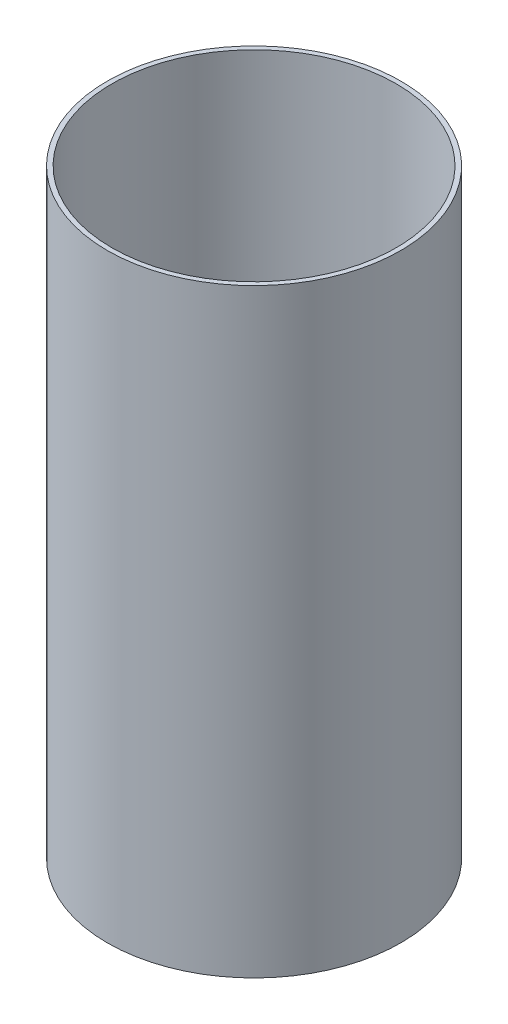
from build123d import *

# Parameters (mm, degrees)
SKETCH1_R           = 104.14
SKETCH1_R_2         = 100.838
BOSS_EXTRUDE1_DEPTH = 212.725


with BuildPart() as part:
    # Sketch1 → Boss-Extrude1 (new, symmetric)
    with BuildSketch(Plane(origin=(0, 0, 0), x_dir=(1, 0, 0), z_dir=(0, 1, 0))):
        with Locations(Location((0, 0, 0), (0, 0, 270))):
            Circle(SKETCH1_R)
        with Locations(Location((0, 0, 0), (0, 0, 270))):
            Circle(SKETCH1_R_2, mode=Mode.SUBTRACT)
    extrude(amount=BOSS_EXTRUDE1_DEPTH, both=True)


solid = part.part
